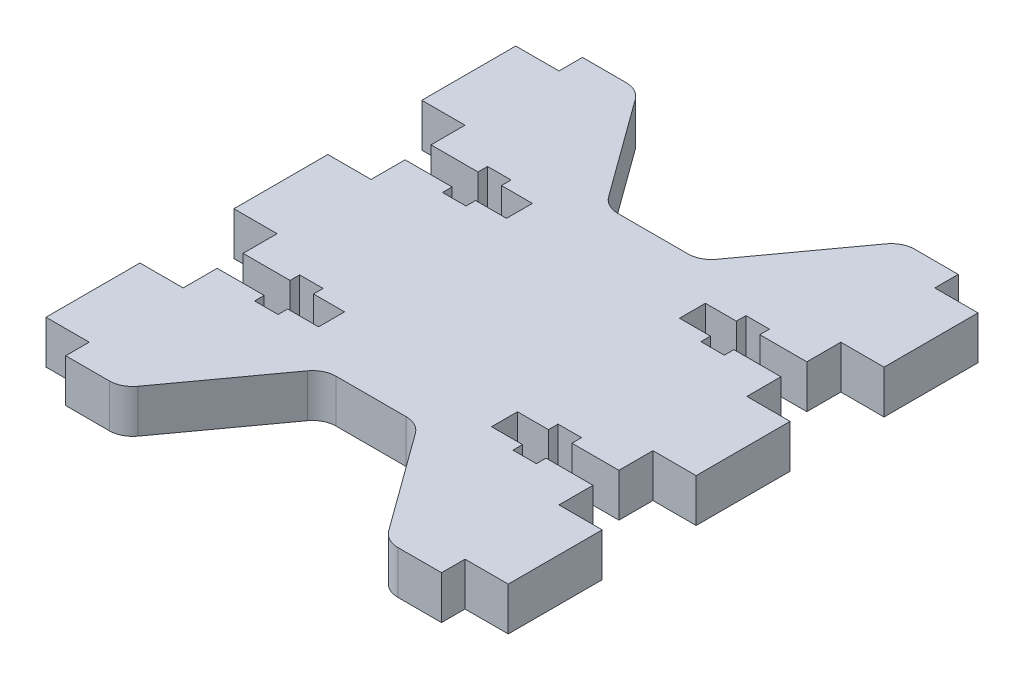
from build123d import *

# Parameters (mm, degrees)
BOSS_EXTRUDE1_DEPTH = 5.842
FILLET1_R           = 3.175


with BuildPart() as part:
    # Sketch1 → Boss-Extrude1 (new body)
    with BuildSketch(Plane(origin=(0, 0, 0), x_dir=(1, 0, 0), z_dir=(0, 1, 0))):
        Polygon((25.4, -34.925), (17.895454545, -34.925), (6.35, -19.05), (-6.35, -19.05), (-17.895454545, -34.925), (-25.4, -34.925), (-25.4, -31.75), (-31.242, -31.75), (-31.242, -19.05), (-25.4, -19.05), (-25.4, -14.4526), (-19.05, -14.4526), (-19.05, -15.748), (-15.875, -15.748), (-15.875, -14.4526), (-11.692, -14.4526), (-11.692, -10.9474), (-15.875, -10.9474), (-15.875, -9.652), (-19.05, -9.652), (-19.05, -10.9474), (-25.4, -10.9474), (-25.4, -6.35), (-31.242, -6.35), (-31.242, 6.35), (-25.4, 6.35), (-25.4, 10.9474), (-19.05, 10.9474), (-19.05, 9.652), (-15.875, 9.652), (-15.875, 10.9474), (-11.692, 10.9474), (-11.692, 14.4526), (-15.875, 14.4526), (-15.875, 15.748), (-19.05, 15.748), (-19.05, 14.4526), (-25.4, 14.4526), (-25.4, 19.05), (-31.242, 19.05), (-31.242, 31.75), (-25.4, 31.75), (-25.4, 34.925), (-17.895454545, 34.925), (-6.35, 19.05), (6.35, 19.05), (17.895454545, 34.925), (25.4, 34.925), (25.4, 31.75), (31.242, 31.75), (31.242, 19.05), (25.4, 19.05), (25.4, 14.4526), (19.05, 14.4526), (19.05, 15.748), (15.875, 15.748), (15.875, 14.4526), (11.692, 14.4526), (11.692, 10.9474), (15.875, 10.9474), (15.875, 9.652), (19.05, 9.652), (19.05, 10.9474), (25.4, 10.9474), (25.4, 6.35), (31.242, 6.35), (31.242, -6.35), (25.4, -6.35), (25.4, -10.9474), (19.05, -10.9474), (19.05, -9.652), (15.875, -9.652), (15.875, -10.9474), (11.692, -10.9474), (11.692, -14.4526), (15.875, -14.4526), (15.875, -15.748), (19.05, -15.748), (19.05, -14.4526), (25.4, -14.4526), (25.4, -19.05), (31.242, -19.05), (31.242, -31.75), (25.4, -31.75), align=None)
    extrude(amount=BOSS_EXTRUDE1_DEPTH)

    # Fillet1
    fillet1_edges = [part.edges().sort_by_distance(p)[0] for p in [
        (-17.895454545, 2.921, -34.925),
        (-6.35, 2.921, -19.05),
        (6.35, 2.921, -19.05),
        (17.895454545, 2.921, -34.925),
        (17.895454545, 2.921, 34.925),
        (6.35, 2.921, 19.05),
        (-6.35, 2.921, 19.05),
        (-17.895454545, 2.921, 34.925),
    ]]
    fillet(fillet1_edges, radius=FILLET1_R)


solid = part.part
